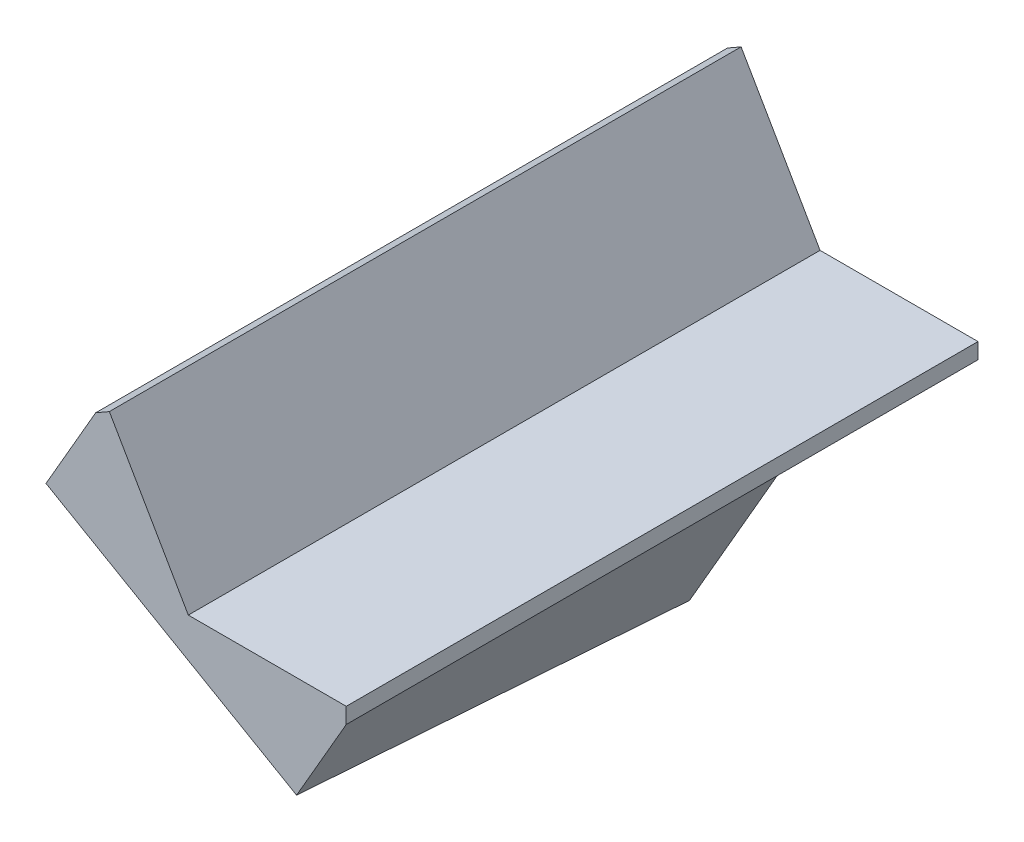
from build123d import *

# Parameters (mm, degrees)
BOSS_EXTRUDE2_DEPTH      = 80
BOSS_EXTRUDE3_DEPTH      = 18.320508
BOSS_EXTRUDE3_DEPTH_BACK = 18.320508
BOSS_EXTRUDE4_REACH      = 87.413
SKETCH6_W                = 54.567226391
SKETCH6_H                = 16.588457268
BOSS_EXTRUDE5_REACH      = 87.413
SKETCH8_W                = 16.588457268
SKETCH8_H                = 54.567226391


with BuildPart() as part:
    # Sketch3 → Boss-Extrude2 (new body)
    with BuildSketch(Plane.XY):
        Polygon((0, 0), (-10.577350269, 18.320508076), (-8.845299462, 19.320508076), (1.154700538, 2), (21.154700538, 2), (21.154700538, 0), align=None)
    extrude(amount=BOSS_EXTRUDE2_DEPTH)

    # Sketch5 → Boss-Extrude3 (add, two sides: drawn at the far end of the back side and taken through both)
    with BuildSketch(Plane(origin=(0, 0, 0), x_dir=(0, 0, -1), z_dir=(0.86602540378444, -0.4999999999999977, 0)).offset(-BOSS_EXTRUDE3_DEPTH_BACK)):
        Polygon((-25.432773609, -9.621674275), (-25.432773609, -11.621674275), (-80, -2), (-80, 0), (-80, 1), (-25.432773609, 1), (-25.432773609, 0), align=None)
    extrude(amount=BOSS_EXTRUDE3_DEPTH + BOSS_EXTRUDE3_DEPTH_BACK)

    # Sketch6 → Boss-Extrude4 (add, up to next)
    with BuildSketch(Plane(origin=(0.4999999999999976, 0.8660254037844397, 0), x_dir=(0, 0, -1), z_dir=(0.49999999999999784, 0.8660254037844398, 0)), mode=Mode.PRIVATE) as boss_extrude4_sk1:
        with Locations((-52.716386805, 10.026279442)):
            Rectangle(SKETCH6_W, SKETCH6_H)
    boss_extrude4_tool1 = extrude(boss_extrude4_sk1.sketch, amount=BOSS_EXTRUDE4_REACH, mode=Mode.PRIVATE) - part.part
    add(boss_extrude4_tool1.solids().sort_by_distance((-8.183013, 5.879165, 52.716387))[0])

    # Sketch8 → Boss-Extrude5 (add, up to next)
    with BuildSketch(Plane(origin=(0.4999999999999976, 0.8660254037844397, 0), x_dir=(0.8660254037844399, -0.4999999999999979, 0), z_dir=(0.49999999999999784, 0.8660254037844398, 0)), mode=Mode.PRIVATE) as boss_extrude5_sk1:
        with Locations((10.026279442, -52.716386805)):
            Rectangle(SKETCH8_W, SKETCH8_H)
    boss_extrude5_tool1 = extrude(boss_extrude5_sk1.sketch, amount=BOSS_EXTRUDE5_REACH, mode=Mode.PRIVATE) - part.part
    add(boss_extrude5_tool1.solids().sort_by_distance((9.183013, -4.147114, 52.716387))[0])


solid = part.part
